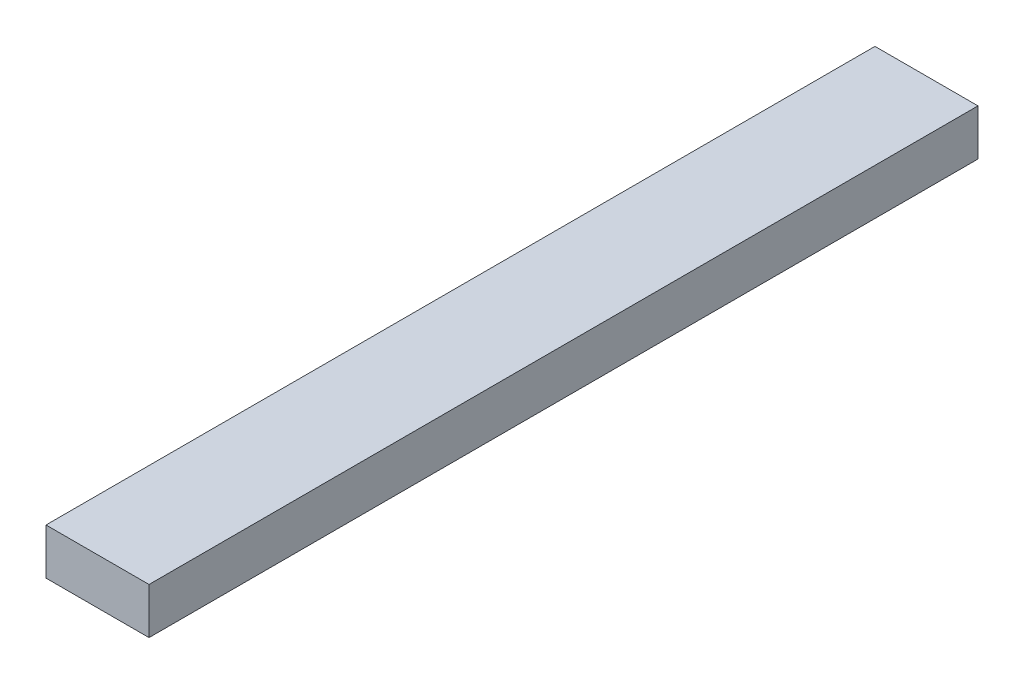
from build123d import *

# Parameters (mm, degrees)
SKETCH1_W           = 16.6624
SKETCH1_H           = 37.2872
BOSS_EXTRUDE1_DEPTH = 150


with BuildPart() as part:
    # Sketch1 → Boss-Extrude1 (new, symmetric)
    with BuildSketch(Plane(origin=(0, 0, 0), x_dir=(0, 1, 0), z_dir=(0, 0, 1))):
        Rectangle(SKETCH1_W, SKETCH1_H)
    extrude(amount=BOSS_EXTRUDE1_DEPTH, both=True)


solid = part.part
